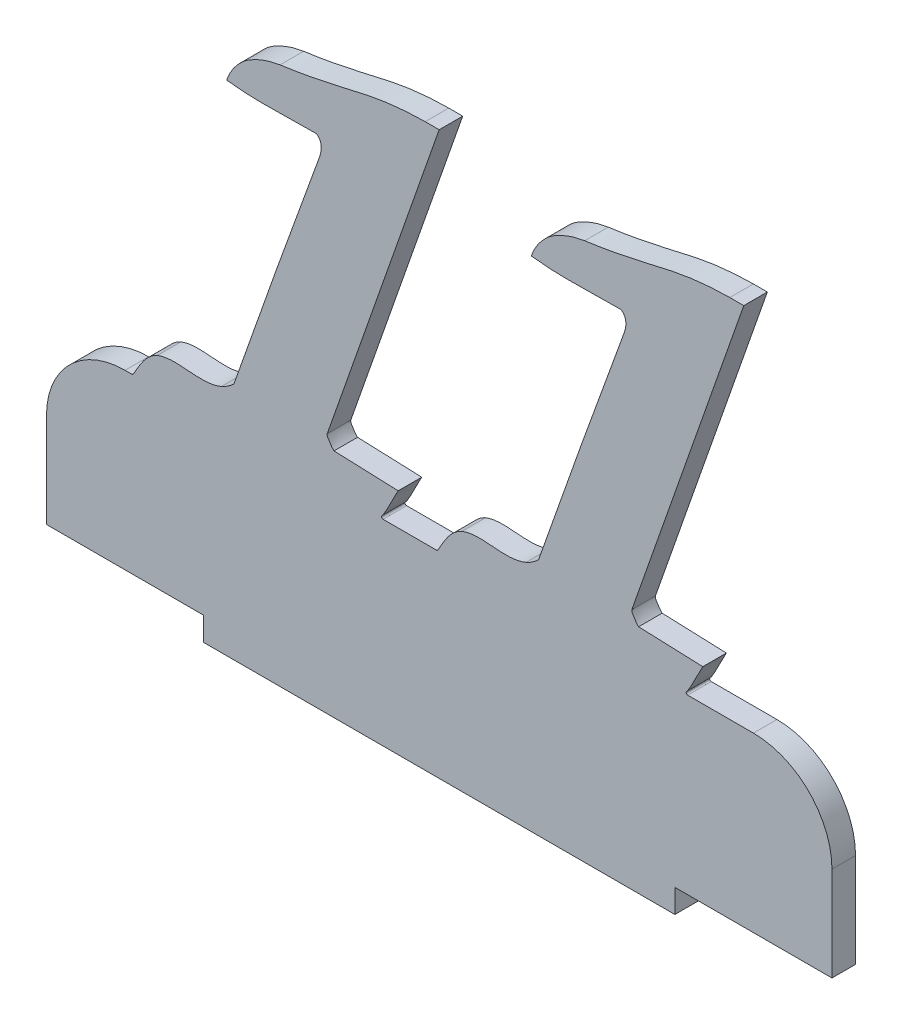
from build123d import *

# Parameters (mm, degrees)
BOSS_EXTRUDE1_DEPTH = 3
FILLET1_R           = 10
FILLET2_R           = 0.2


with BuildPart() as part:
    # Sketch1 → Boss-Extrude1 (new body)
    with BuildSketch(Plane.XY):
        with BuildLine():
            Line((42.358686368, 22.000000982), (49.772401671, 22.000000982))
            add(Edge.make_bspline(
                [(49.772401671, 22.000000982), (49.840272704, 22.116351885), (50.1551903, 22.666226688), (50.950894785, 24.093636109), (51.94551412, 25.26324692), (52.886288967, 25.69272444)],
                knots=[0.181427978, 0.181427978, 0.181427978, 0.181427978, 0.24891213, 0.498932816, 1, 1, 1, 1], degree=3))
            add(Edge.make_bspline(
                [(52.886288967, 25.69272444), (54.227657261, 26.21198845), (56.978395025, 25.93722039), (59.747728448, 25.781572291), (61.056734627, 26.357306144)],
                knots=[0, 0, 0, 0, 0.501451854, 1, 1, 1, 1], degree=3))
            add(Edge.make_bspline(
                [(61.056734627, 26.357306144), (61.938277564, 26.747818697), (62.640002805, 27.412818263)],
                knots=[0, 0, 0, 1, 1, 1], degree=2))
            add(Edge.make_bspline(
                [(62.640002805, 27.412818263), (64.422298684, 32.447991264), (67.947295887, 42.570792519), (71.63632388, 52.63498927), (73.468775284, 57.690378858)],
                knots=[0, 0, 0, 0, 0.498322561, 1, 1, 1, 1], degree=3))
            add(Edge.make_bspline(
                [(73.468775284, 57.690378858), (73.65195235, 58.18791707), (73.947138477, 59.154492844), (73.494544705, 60.065888317), (73.136484432, 60.270519593)],
                knots=[0, 0, 0, 0, 0.581397084, 1, 1, 1, 1], degree=3))
            add(Edge.make_bspline(
                [(73.136484432, 60.270519593), (71.219763549, 60.304316664), (67.414772669, 60.120408261), (63.601790951, 60.225145139), (61.721316332, 60.4659848)],
                knots=[0, 0, 0, 0, 0.503014916, 1, 1, 1, 1], degree=3))
            add(Edge.make_bspline(
                [(61.721316332, 60.4659848), (61.953278841, 61.133157294), (62.437522451, 62.08211133), (63.355516567, 63.142847502), (64.128800308, 63.865372538), (65.076762001, 64.419081128), (66.503780011, 65.101780751), (67.695837691, 65.416597624), (68.523505542, 65.548080187)],
                knots=[0, 0, 0, 0, 0.237267367, 0.352023708, 0.469658656, 0.590380818, 0.718477308, 1, 1, 1, 1], degree=3))
            add(Edge.make_bspline(
                [(68.523505542, 65.548080187), (71.635771568, 65.94651733), (75.497539161, 66.798521287), (80.119338716, 67.878335493), (83.19923981, 68.360811237), (85.492331103, 68.508361677), (86.994967622, 68.519151336)],
                knots=[0, 0, 0, 0, 0.501477793, 0.632810111, 0.759518477, 1, 1, 1, 1], degree=3))
            add(Edge.make_bspline(
                [(86.994967622, 68.519151336), (87.203463843, 68.519151336), (87.796374971, 68.519151336), (88.3892861, 68.519151336), (88.773701007, 68.519151336)],
                knots=[0, 0, 0, 0, 0.351648352, 1, 1, 1, 1], degree=3))
            Line((88.773701007, 68.519151336), (74.524287403, 27.881934761))
            add(Edge.make_bspline(
                [(74.524287403, 27.881934761), (74.471104748, 27.682138266), (74.802744483, 27.172445206), (75.080434831, 26.689662332), (75.384334314, 26.415945707)],
                knots=[0, 0, 0, 0, 0.324502414, 1, 1, 1, 1], degree=3))
            Line((75.384334314, 26.415945707), (83.554779975, 26.103201375))
            add(Edge.make_bspline(
                [(83.554779975, 26.103201375), (82.959840411, 25.089982249), (82.414680301, 23.767742871), (81.574001976, 22.395101634), (81.262536262, 22.101391942), (81.138983475, 22.000000982)],
                knots=[0, 0, 0, 0, 0.504343167, 0.619768133, 0.688442197, 0.688442197, 0.688442197, 0.688442197], degree=3))
            Line((81.138983475, 22.000000982), (100, 22.000000982))
            Line((100, 22.000000982), (100, 0))
            Line((100, 0), (80, 0))
            Line((80, 0), (80, -3))
            Line((80, -3), (20, -3))
            Line((20, -3), (20, 0))
            Line((20, 0), (0, 0))
            Line((0, 0), (0, 22.000000982))
            Line((0, 22.000000982), (10.992104564, 22.000000982))
            add(Edge.make_bspline(
                [(10.992104564, 22.000000982), (11.059975596, 22.116351885), (11.374893193, 22.666226688), (12.170597678, 24.093636109), (13.165217013, 25.26324692), (14.105991859, 25.69272444)],
                knots=[0.181427978, 0.181427978, 0.181427978, 0.181427978, 0.24891213, 0.498932816, 1, 1, 1, 1], degree=3))
            add(Edge.make_bspline(
                [(14.105991859, 25.69272444), (15.447360154, 26.21198845), (18.198097918, 25.93722039), (20.967431341, 25.781572291), (22.27643752, 26.357306144)],
                knots=[0, 0, 0, 0, 0.501451854, 1, 1, 1, 1], degree=3))
            add(Edge.make_bspline(
                [(22.27643752, 26.357306144), (23.157980457, 26.747818697), (23.859705698, 27.412818263)],
                knots=[0, 0, 0, 1, 1, 1], degree=2))
            add(Edge.make_bspline(
                [(23.859705698, 27.412818263), (25.642001577, 32.447991264), (29.16699878, 42.570792519), (32.856026773, 52.63498927), (34.688478177, 57.690378858)],
                knots=[0, 0, 0, 0, 0.498322561, 1, 1, 1, 1], degree=3))
            add(Edge.make_bspline(
                [(34.688478177, 57.690378858), (34.871655243, 58.18791707), (35.16684137, 59.154492844), (34.714247598, 60.065888317), (34.356187325, 60.270519593)],
                knots=[0, 0, 0, 0, 0.581397084, 1, 1, 1, 1], degree=3))
            add(Edge.make_bspline(
                [(34.356187325, 60.270519593), (32.439466442, 60.304316664), (28.634475562, 60.120408261), (24.821493844, 60.225145139), (22.941019225, 60.4659848)],
                knots=[0, 0, 0, 0, 0.503014916, 1, 1, 1, 1], degree=3))
            add(Edge.make_bspline(
                [(22.941019225, 60.4659848), (23.172981734, 61.133157294), (23.657225344, 62.08211133), (24.57521946, 63.142847502), (25.348503201, 63.865372538), (26.296464893, 64.419081128), (27.723482904, 65.101780751), (28.915540584, 65.416597624), (29.743208435, 65.548080187)],
                knots=[0, 0, 0, 0, 0.237267367, 0.352023708, 0.469658656, 0.590380818, 0.718477308, 1, 1, 1, 1], degree=3))
            add(Edge.make_bspline(
                [(29.743208435, 65.548080187), (32.85547446, 65.94651733), (36.717242054, 66.798521287), (41.339041609, 67.878335493), (44.418942703, 68.360811237), (46.712033996, 68.508361677), (48.214670515, 68.519151336)],
                knots=[0, 0, 0, 0, 0.501477793, 0.632810111, 0.759518477, 1, 1, 1, 1], degree=3))
            add(Edge.make_bspline(
                [(48.214670515, 68.519151336), (48.423166736, 68.519151336), (49.016077864, 68.519151336), (49.608988993, 68.519151336), (49.9934039, 68.519151336)],
                knots=[0, 0, 0, 0, 0.351648352, 1, 1, 1, 1], degree=3))
            Line((49.9934039, 68.519151336), (35.743990296, 27.881934761))
            add(Edge.make_bspline(
                [(35.743990296, 27.881934761), (35.690807641, 27.682138266), (36.022447376, 27.172445206), (36.300137724, 26.689662332), (36.604037207, 26.415945707)],
                knots=[0, 0, 0, 0, 0.324502414, 1, 1, 1, 1], degree=3))
            Line((36.604037207, 26.415945707), (44.774482868, 26.103201375))
            add(Edge.make_bspline(
                [(44.774482868, 26.103201375), (44.179543303, 25.089982249), (43.634383194, 23.767742871), (42.793704869, 22.395101634), (42.482239154, 22.101391942), (42.358686368, 22.000000982)],
                knots=[0, 0, 0, 0, 0.504343167, 0.619768133, 0.688442197, 0.688442197, 0.688442197, 0.688442197], degree=3))
        make_face()
    extrude(amount=BOSS_EXTRUDE1_DEPTH)

    # Fillet1
    fillet1_edges = [part.edges().sort_by_distance(p)[0] for p in [
        (100, 22.000000982, 1.5),
        (0, 22.000000982, 1.5),
    ]]
    fillet(fillet1_edges, radius=FILLET1_R)

    # Fillet2
    fillet2_edges = [part.edges().sort_by_distance(p)[0] for p in [
        (49.772401671, 22.000000982, 1.5),
        (81.138983475, 22.000000982, 1.5),
        (42.358686368, 22.000000982, 1.5),
        (10.992104564, 22.000000982, 1.5),
    ]]
    fillet(fillet2_edges, radius=FILLET2_R)


solid = part.part
